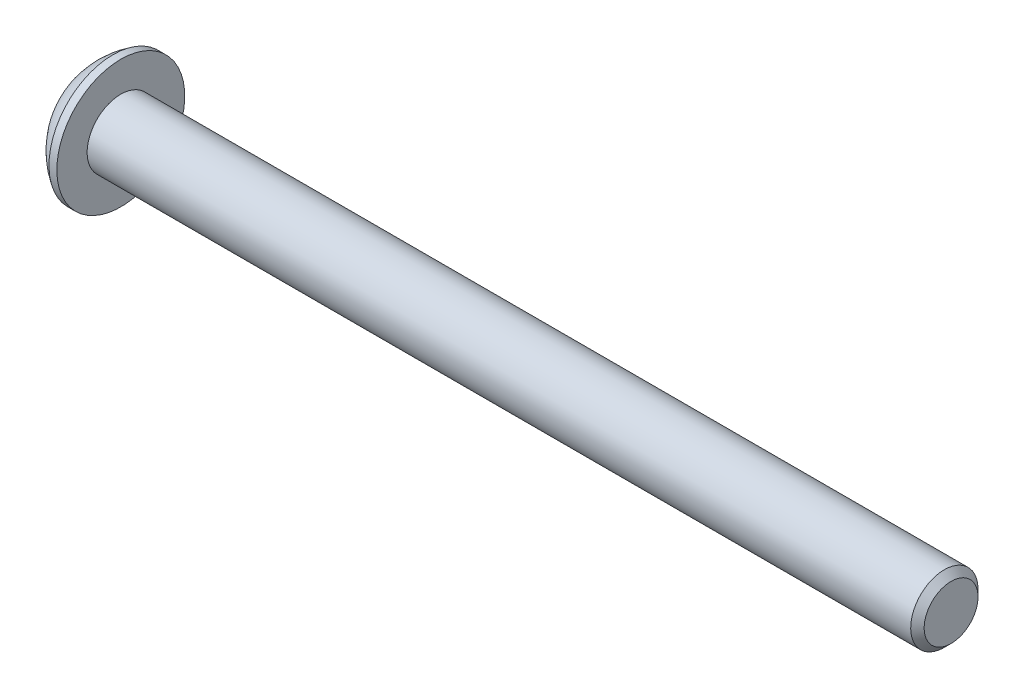
from build123d import *

# Parameters (mm, degrees)
CHAMFER1_SIZE      = 0.3
CUT_EXTRUDE1_DEPTH = 1


with BuildPart() as part:
    # Sketch1 → Revolve1 (revolve)
    with BuildSketch(Plane.XY):
        with BuildLine():
            Line((38.65, 0), (0, 0))
            Line((0, 0), (0, 1.425))
            ThreePointArc((0, 1.425), (0.549895392, 2.228823502), (1.3, 2.85))
            Line((1.3, 2.85), (1.65, 2.85))
            Line((1.65, 2.85), (1.65, 1.5))
            Line((1.65, 1.5), (38.65, 1.5))
            Line((38.65, 1.5), (38.65, 0))
        make_face()
    revolve(axis=Axis((38.65, 0, 0), (-1, 0, 0)))

    # Chamfer1
    chamfer1_edges = [part.edges().sort_by_distance(p)[0] for p in [
        (38.65, -1.5, 0),
    ]]
    chamfer(chamfer1_edges, length=CHAMFER1_SIZE)

    # Sketch2 → Cut-Extrude1 (cut)
    with BuildSketch(Plane.ZY):
        Polygon((1, 0.577350269), (0, 1.154700538), (-1, 0.577350269), (-1, -0.577350269), (0, -1.154700538), (1, -0.577350269), align=None)
    extrude(amount=-CUT_EXTRUDE1_DEPTH, mode=Mode.SUBTRACT)


solid = part.part
